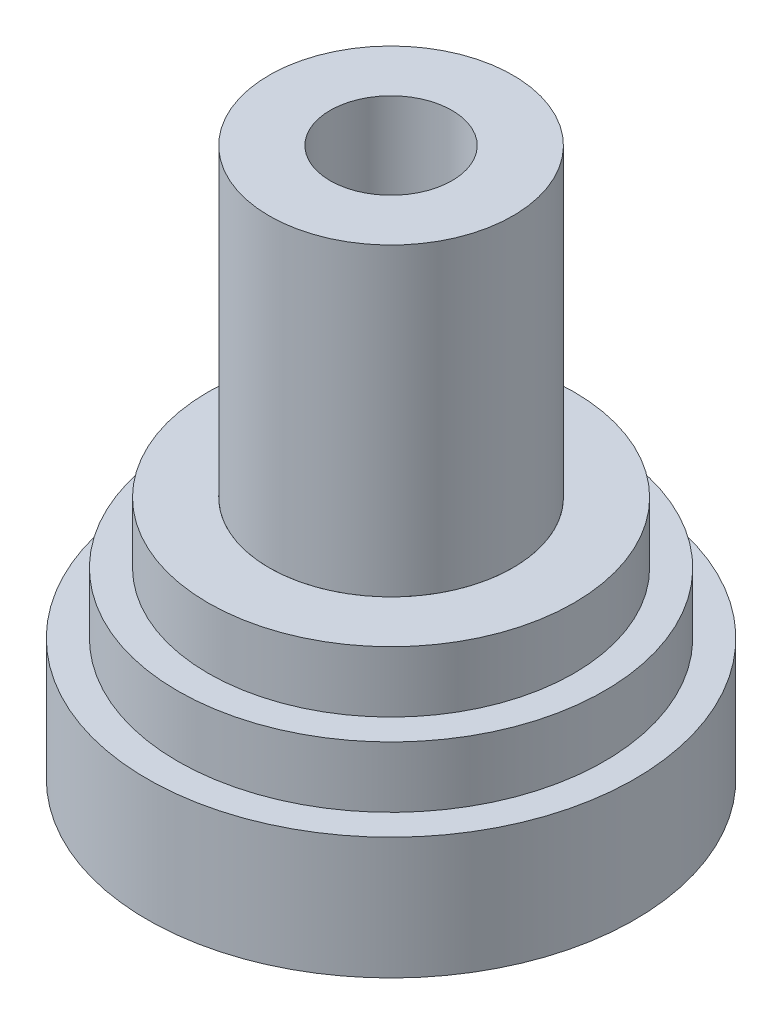
from build123d import *

# Parameters (mm, degrees)
SKETCH1_R           = 20
BOSS_EXTRUDE1_DEPTH = 50
SKETCH2_R           = 10
CUT_EXTRUDE1_DEPTH  = 50


with BuildPart() as part:
    # Sketch1 → Boss-Extrude1 (new body)
    with BuildSketch(Plane(origin=(0, 0, 0), x_dir=(1, 0, 0), z_dir=(0, 1, 0))):
        with Locations(Location((0, 0, 0), (0, 0, 270))):
            Circle(SKETCH1_R)
    extrude(amount=BOSS_EXTRUDE1_DEPTH)

    # Sketch2 → Cut-Extrude1 (cut)
    with BuildSketch(Plane(origin=(0, 50, 0), x_dir=(1, 0, 0), z_dir=(0, 1, 0))):
        with Locations(Location((0, 0, 0), (0, 0, 270))):
            Circle(SKETCH2_R)
    extrude(amount=-CUT_EXTRUDE1_DEPTH, mode=Mode.SUBTRACT)


with BuildPart() as body_2:
    # Sketch4 → Revolve1 (revolve)
    with BuildSketch(Plane(origin=(0, 0, 0), x_dir=(0, 0, -1), z_dir=(1, 0, 0))):
        Polygon((30, 0), (30, -10), (35, -10), (35, -20), (40, -20), (40, -40), (30, -40), (30, -15), (20, -15), (20, 0), align=None)
    revolve(axis=Axis((0, 0, 0), (0, 1, 0)))


solid = Compound([part.part, body_2.part])
